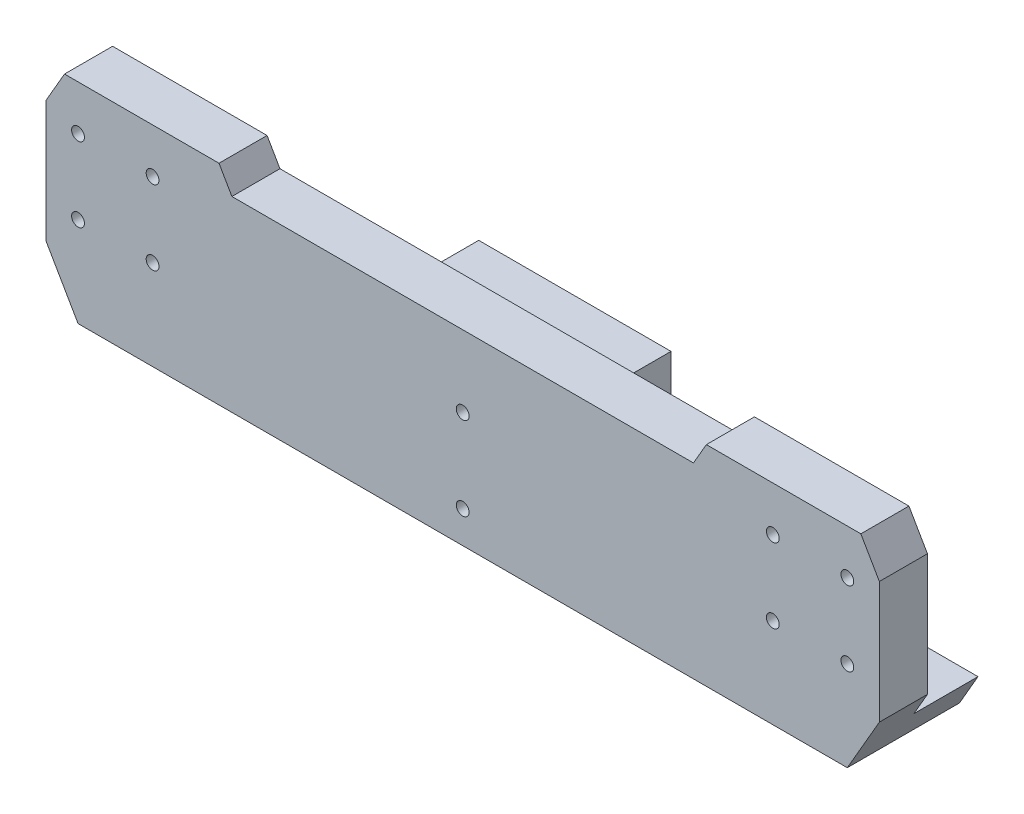
from build123d import *

# Parameters (mm, degrees)
SKETCH1_R           = 2
BOSS_EXTRUDE1_DEPTH = 15
BOSS_EXTRUDE2_START = -35
SKETCH2_R           = 2
BOSS_EXTRUDE2_DEPTH = 35
SKETCH4_R           = 2
CUT_EXTRUDE1_DEPTH  = 10


with BuildPart() as part:
    # Sketch1 → Boss-Extrude1 (new body)
    with BuildSketch(Plane.XY):
        Polygon((130, -41.026010691), (130, -3.026010691), (124.226790646, 6.973481233), (76.026141267, 6.973481233), (72, 0), (-72, 0), (-76.026141267, 6.973481233), (-124.226790646, 6.973481233), (-130, -3.026010691), (-130, -41.026010691), (-120, -58.346518767), (120, -58.346518767), align=None)
        with Locations((-120, -7.026518767)):
            Circle(SKETCH1_R, mode=Mode.SUBTRACT)
        with Locations((-96.75, -7.026518767)):
            Circle(SKETCH1_R, mode=Mode.SUBTRACT)
        with Locations((-96.75, -30.276518767)):
            Circle(SKETCH1_R, mode=Mode.SUBTRACT)
        with Locations((-120, -30.276518767)):
            Circle(SKETCH1_R, mode=Mode.SUBTRACT)
        with Locations((120, -7.026518767)):
            Circle(SKETCH1_R, mode=Mode.SUBTRACT)
        with Locations((120, -30.276518767)):
            Circle(SKETCH1_R, mode=Mode.SUBTRACT)
        with Locations((96.75, -7.026518767)):
            Circle(SKETCH1_R, mode=Mode.SUBTRACT)
        with Locations((96.75, -30.276518767)):
            Circle(SKETCH1_R, mode=Mode.SUBTRACT)
        with Locations((0, -48.346518767)):
            Circle(SKETCH1_R, mode=Mode.SUBTRACT)
        with Locations((0, -22.346518767)):
            Circle(SKETCH1_R, mode=Mode.SUBTRACT)
    extrude(amount=BOSS_EXTRUDE1_DEPTH)

    # Sketch2 → Boss-Extrude2 (add)
    with BuildSketch(Plane.XY.offset(15).offset(BOSS_EXTRUDE2_START)):
        Polygon((-125.773502692, -48.346518767), (-120, -58.346518767), (120, -58.346518767), (125.773502692, -48.346518767), (30, -48.346518767), (30, -8.346518767), (-30, -8.346518767), (-30, -48.346518767), align=None)
        with Locations((0, -48.346518767)):
            Circle(SKETCH2_R, mode=Mode.SUBTRACT)
        with Locations((0, -22.346518767)):
            Circle(SKETCH2_R, mode=Mode.SUBTRACT)
    extrude(amount=BOSS_EXTRUDE2_DEPTH)

    # Sketch4 → Cut-Extrude1 (cut)
    with BuildSketch(Plane.XZ.offset(58.346518767)):
        with Locations((-72, -2.5)):
            Circle(SKETCH4_R)
        with Locations((-42, -2.5)):
            Circle(SKETCH4_R)
        with Locations(Location((42, -2.5, 0), (0, 0, 180))):
            Circle(SKETCH4_R)
        with Locations(Location((72, -2.5, 0), (0, 0, 180))):
            Circle(SKETCH4_R)
    extrude(amount=-CUT_EXTRUDE1_DEPTH, mode=Mode.SUBTRACT)


solid = part.part
